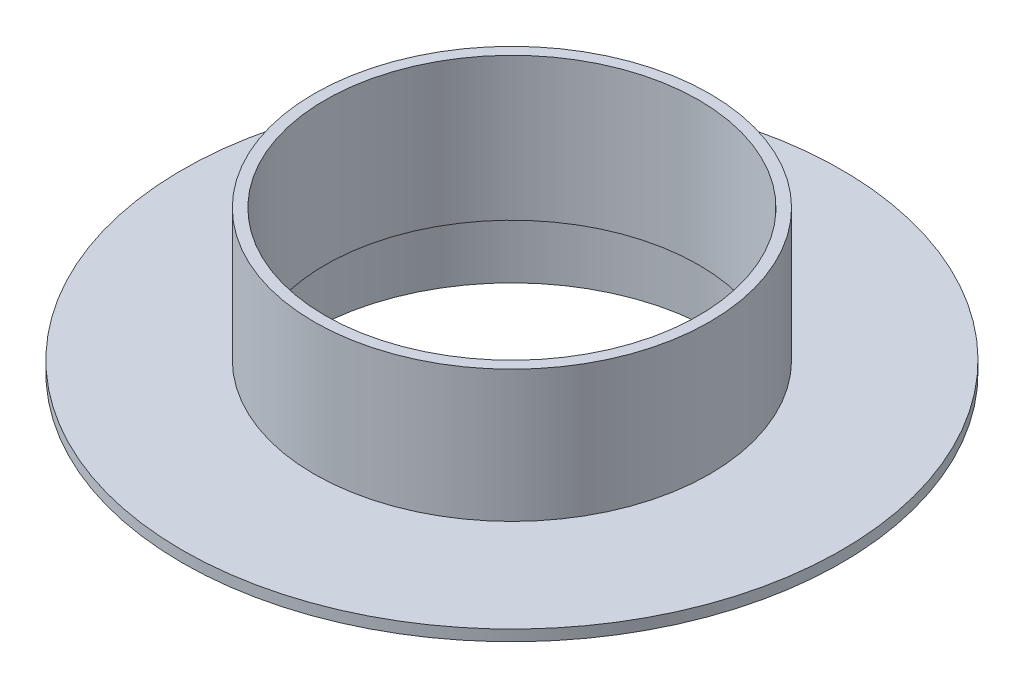
from build123d import *

# Parameters (mm, degrees)
SKETCH_2_R          = 150
EXTRUDE_1_DEPTH     = 5
SKETCH_3_R          = 90
EXTRUDE_2_DEPTH     = 60
SKETCH_4_R          = 85
CUT_EXTRUDE_1_DEPTH = 222.867077323
SKETCH_5_R          = 97.5
SKETCH_5_R_2        = 92.5
EXTRUDE_3_DEPTH     = 30


with BuildPart() as part:
    # 草图2 → 凸台-拉伸1 (new body)
    with BuildSketch(Plane(origin=(0, 0, 0), x_dir=(1, 0, 0), z_dir=(0, 1, 0))):
        with Locations(Location((0, 0, 0), (0, 0, 270))):
            Circle(SKETCH_2_R)
    extrude(amount=EXTRUDE_1_DEPTH)

    # 草图3 → 凸台-拉伸2 (add)
    with BuildSketch(Plane(origin=(0, 5, 0), x_dir=(1, 0, 0), z_dir=(0, 1, 0))):
        with Locations(Location((0, 0, 0), (0, 0, 270))):
            Circle(SKETCH_3_R)
    extrude(amount=EXTRUDE_2_DEPTH)

    # 草图4 → 切除-拉伸1 (cut, through all)
    with BuildSketch(Plane.XZ):
        with Locations(Location((0, 0, 0), (0, 0, 270))):
            Circle(SKETCH_4_R)
    extrude(amount=-CUT_EXTRUDE_1_DEPTH, mode=Mode.SUBTRACT)

    # 草图5 → 凸台-拉伸3 (add)
    with BuildSketch(Plane.XZ):
        with Locations(Location((0, 0, 0), (0, 0, 90))):
            Circle(SKETCH_5_R)
        with Locations(Location((0, 0, 0), (0, 0, 270))):
            Circle(SKETCH_5_R_2, mode=Mode.SUBTRACT)
    extrude(amount=EXTRUDE_3_DEPTH)


solid = part.part
